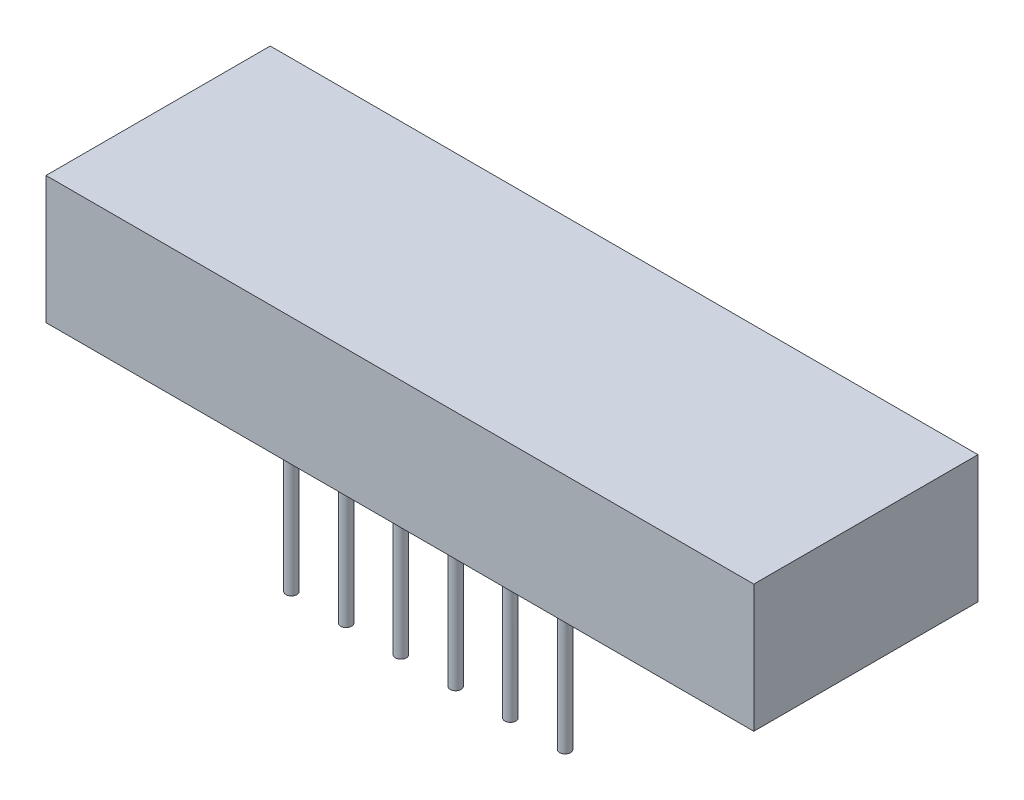
from build123d import *

# Parameters (mm, degrees)
SKETCH_1_W      = 32.2
SKETCH_1_H      = 10.2
EXTRUDE_1_DEPTH = 5.8
SKETCH_2_R      = 0.25
EXTRUDE_2_DEPTH = 6.3


with BuildPart() as part:
    # 草图1 → 拉伸1 (new body)
    with BuildSketch(Plane(origin=(0, 0, 0), x_dir=(1, 0, 0), z_dir=(0, 1, 0))):
        Rectangle(SKETCH_1_W, SKETCH_1_H)
    extrude(amount=EXTRUDE_1_DEPTH)

    # 草图2 → 拉伸2 (add)
    with BuildSketch(Plane.XZ):
        with Locations(Location((6.224686657, 3.81, 0), (0, 0, 90))):
            Circle(SKETCH_2_R)
        with Locations(Location((3.734811994, 3.81, 0), (0, 0, 90))):
            Circle(SKETCH_2_R)
        with Locations(Location((1.244937331, 3.81, 0), (0, 0, 90))):
            Circle(SKETCH_2_R)
        with Locations(Location((-1.244937331, 3.81, 0), (0, 0, 90))):
            Circle(SKETCH_2_R)
        with Locations(Location((-3.734811994, 3.81, 0), (0, 0, 90))):
            Circle(SKETCH_2_R)
        with Locations(Location((-6.224686657, 3.81, 0), (0, 0, 90))):
            Circle(SKETCH_2_R)
        with Locations(Location((-6.224686657, -3.81, 0), (0, 0, 90))):
            Circle(SKETCH_2_R)
        with Locations(Location((-3.734811994, -3.81, 0), (0, 0, 90))):
            Circle(SKETCH_2_R)
        with Locations(Location((-1.244937331, -3.81, 0), (0, 0, 90))):
            Circle(SKETCH_2_R)
        with Locations(Location((1.244937331, -3.81, 0), (0, 0, 90))):
            Circle(SKETCH_2_R)
        with Locations(Location((3.734811994, -3.81, 0), (0, 0, 90))):
            Circle(SKETCH_2_R)
        with Locations(Location((6.224686657, -3.81, 0), (0, 0, 90))):
            Circle(SKETCH_2_R)
    extrude(amount=EXTRUDE_2_DEPTH)


solid = part.part
